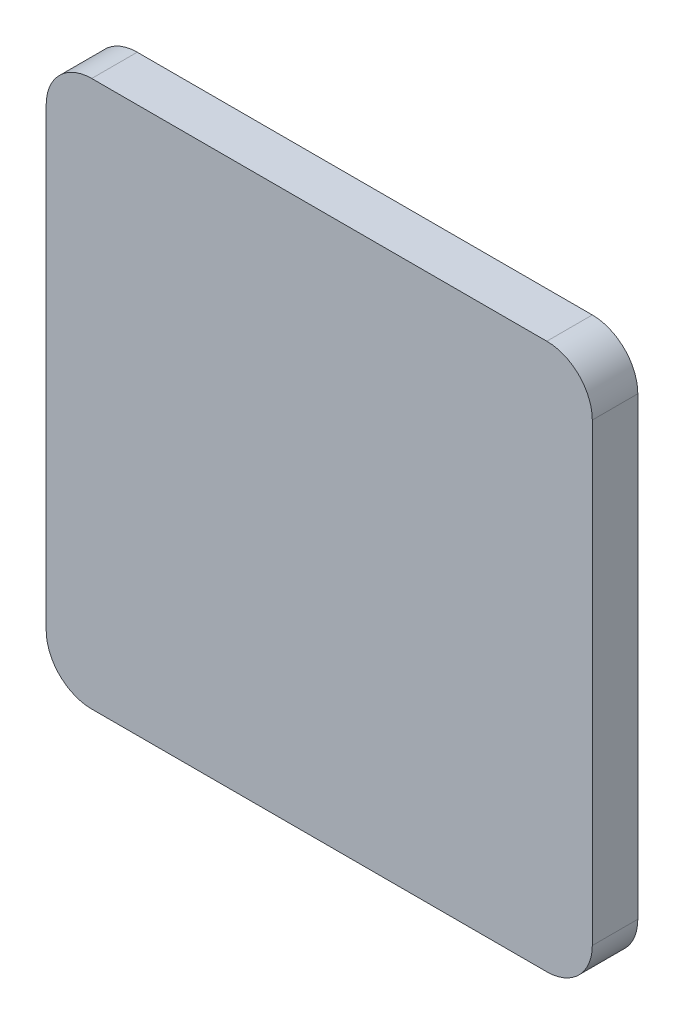
from build123d import *

# Parameters (mm, degrees)
BOSS_EXTRUDE1_DEPTH = 10


with BuildPart() as part:
    # Sketch1 → Boss-Extrude1 (new body)
    with BuildSketch(Plane.XY):
        with BuildLine():
            Line((-50, 60), (50, 60))
            ThreePointArc((50, 60), (57.071067812, 57.071067812), (60, 50))
            Line((60, 50), (60, -50))
            ThreePointArc((60, -50), (57.071067812, -57.071067812), (50, -60))
            Line((50, -60), (-50, -60))
            ThreePointArc((-50, -60), (-57.071067812, -57.071067812), (-60, -50))
            Line((-60, -50), (-60, 50))
            ThreePointArc((-60, 50), (-57.071067812, 57.071067812), (-50, 60))
        make_face()
    extrude(amount=BOSS_EXTRUDE1_DEPTH)


solid = part.part
